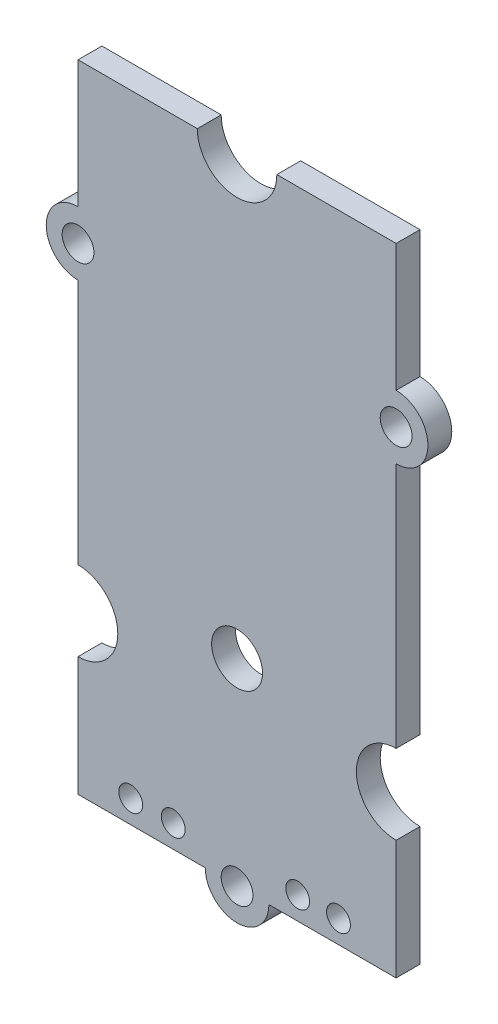
from build123d import *

# Parameters (mm, degrees)
PCB_DEPTH                = 1.5
ESQUISSE3_R              = 1
ESQUISSE3_R_2            = 0.75
TROUS_DEPTH              = 42.788156217
M3_CLEARANCE_HOLE2_D     = 3.2
M3_CLEARANCE_HOLE2_DEPTH = 5
M3_CLEARANCE_HOLE2_TIP   = 0.96137699


with BuildPart() as part:
    # Esquisse2 → PCB (new body)
    with BuildSketch(Plane.XY):
        with BuildLine():
            Line((-10, 0), (-2, 0))
            ThreePointArc((-2, 0), (0, -2), (2, 0))
            Line((2, 0), (10, 0))
            Line((10, 0), (10, 7.5))
            ThreePointArc((10, 7.5), (7.5, 10), (10, 12.5))
            Line((10, 12.5), (10, 28))
            ThreePointArc((10, 28), (12, 30), (10, 32))
            Line((10, 32), (10, 40))
            Line((10, 40), (2.5, 40))
            ThreePointArc((2.5, 40), (0, 37.5), (-2.5, 40))
            Line((-2.5, 40), (-10, 40))
            Line((-10, 40), (-10, 32))
            ThreePointArc((-10, 32), (-12, 30), (-10, 28))
            Line((-10, 28), (-10, 12.5))
            ThreePointArc((-10, 12.5), (-7.5, 10), (-10, 7.5))
            Line((-10, 7.5), (-10, 0))
        make_face()
    extrude(amount=PCB_DEPTH)

    # Esquisse3 → Trous (cut, through all)
    with BuildSketch(Plane.XY.offset(1.5)):
        with Locations((-10, 30)):
            Circle(ESQUISSE3_R)
        with Locations((6.37737312, 1.435143304)):
            Circle(ESQUISSE3_R_2)
        with Locations(Location((10, 30, 0), (0, 0, 180))):
            Circle(ESQUISSE3_R)
        Circle(ESQUISSE3_R)
        with Locations((3.809466202, 1.435143304)):
            Circle(ESQUISSE3_R_2)
        with Locations((-4.012518268, 1.435143304)):
            Circle(ESQUISSE3_R_2)
        with Locations((-6.688956118, 1.435143304)):
            Circle(ESQUISSE3_R_2)
    extrude(amount=-TROUS_DEPTH, mode=Mode.SUBTRACT)

    # M3 Clearance Hole2
    with Locations(Plane(origin=(0, 0, 0), x_dir=(-1, 0, 0), z_dir=(0, 0, -1))):
        with Locations((0, 12.3952)):
            Hole(M3_CLEARANCE_HOLE2_D / 2, depth=M3_CLEARANCE_HOLE2_DEPTH)
            with Locations((0, 0, -(M3_CLEARANCE_HOLE2_DEPTH + M3_CLEARANCE_HOLE2_TIP / 2))):  # 118° drill point
                Cone(0, M3_CLEARANCE_HOLE2_D / 2, M3_CLEARANCE_HOLE2_TIP, mode=Mode.SUBTRACT)


solid = part.part
